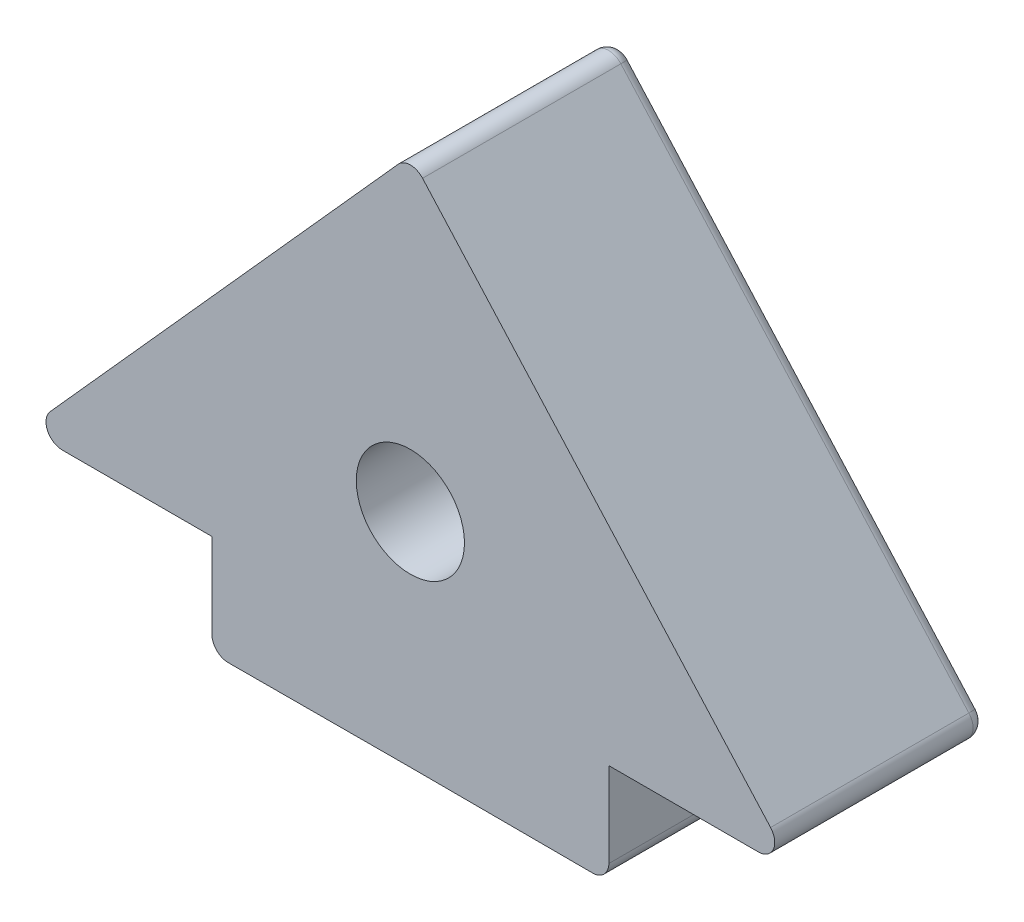
from build123d import *

# Parameters (mm, degrees)
SKETCH_1_R      = 1.8
EXTRUDE_1_DEPTH = 7
SKETCH_2_R      = 1.8
EXTRUDE_2_DEPTH = 2
FILLET_1_R      = 0.4


with BuildPart() as part:
    # 草图1 → 凸台-拉伸1 (new body)
    with BuildSketch(Plane.XY):
        with BuildLine():
            Line((-0.405379361, 8.506127058), (-11.987060741, -4.413883456))
            ThreePointArc((-11.987060741, -4.413883456), (-12.07878067, -4.999252001), (-11.58168138, -5.321682108))
            Line((-11.58168138, -5.321682108), (-6.605215139, -5.321682108))
            Line((-6.605215139, -5.321682108), (-6.605215139, -8.142739227))
            ThreePointArc((-6.605215139, -8.142739227), (-6.445283211, -8.528172909), (-6.059454045, -8.687148374))
            Line((-6.059454045, -8.687148374), (0, -8.672119378))
            Line((0, -8.672119378), (6.059454045, -8.687148374))
            ThreePointArc((6.059454045, -8.687148374), (6.445283211, -8.528172909), (6.605215139, -8.142739227))
            Line((6.605215139, -8.142739227), (6.605215139, -5.321682108))
            Line((6.605215139, -5.321682108), (11.58168138, -5.321682108))
            ThreePointArc((11.58168138, -5.321682108), (12.07878067, -4.999252001), (11.987060741, -4.413883456))
            Line((11.987060741, -4.413883456), (0.405379361, 8.506127058))
            ThreePointArc((0.405379361, 8.506127058), (0, 8.687150048), (-0.405379361, 8.506127058))
        make_face()
        with Locations((0, -1.308282587)):
            Circle(SKETCH_1_R, mode=Mode.SUBTRACT)
    extrude(amount=EXTRUDE_1_DEPTH)

    # 草图2 → 凸台-拉伸2 (add)
    with BuildSketch(Plane(origin=(0, 0, 0), x_dir=(-1, 0, 0), z_dir=(0, 0, -1))):
        with Locations((0, -1.308282587)):
            Circle(SKETCH_2_R)
    extrude(amount=-EXTRUDE_2_DEPTH)

    # 圆角1
    fillet_1_edges = [part.edges().sort_by_distance(p)[0] for p in [
        (6.196220051, 2.046121801, 0),
        (12.07878067, -4.999252001, 0),
        (9.09344826, -5.321682108, 0),
        (6.605215139, -6.732210668, 0),
        (6.445283211, -8.528172909, 0),
        (3.029727022, -8.679633876, 0),
        (-3.029727022, -8.679633876, 0),
        (-6.445283211, -8.528172909, 0),
        (-6.605215139, -6.732210668, 0),
        (-9.09344826, -5.321682108, 0),
        (-12.07878067, -4.999252001, 0),
        (-6.196220051, 2.046121801, 0),
        (0, 8.687150048, 0),
    ]]
    fillet(fillet_1_edges, radius=FILLET_1_R)


solid = part.part
